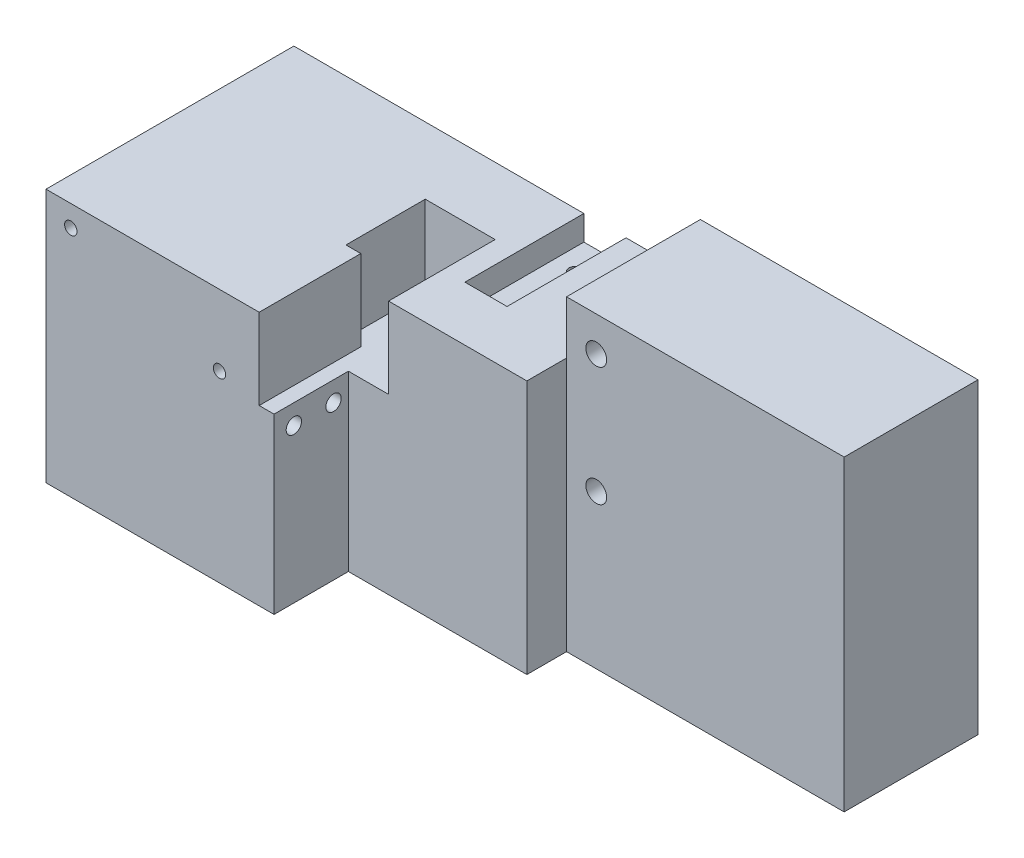
from build123d import *

# Parameters (mm, degrees)
SKETCH1_W                      = 138
SKETCH1_H                      = 50
BOSS_EXTRUDE1_DEPTH            = 62
SKETCH2_W                      = 82
SKETCH2_H                      = 8
CUT_EXTRUDE1_DEPTH             = 160.336122709
SKETCH3_W                      = 56
SKETCH3_H                      = 62
CUT_EXTRUDE2_DEPTH             = 23
CUT_EXTRUDE3_DEPTH             = 19
SKETCH5_W                      = 36
SKETCH5_H                      = 15
CUT_EXTRUDE4_DEPTH             = 157.396930916
M3X0_5_TAPPED_HOLE1_D          = 2.5
M3X0_5_TAPPED_HOLE1_DEPTH      = 12.4
M3X0_5_TAPPED_HOLE1_TIP        = 0.751075774
M4X0_7_TAPPED_HOLE1_D          = 3.3
M4X0_7_TAPPED_HOLE1_DEPTH      = 10.1
M4X0_7_TAPPED_HOLE1_TIP        = 0.991420021
F_3_1_3_1_DIAMETER_HOLE1_D     = 3.1
F_3_1_3_1_DIAMETER_HOLE1_DEPTH = 10
F_3_1_3_1_DIAMETER_HOLE1_TIP   = 0.931333959
SKETCH15_W                     = 82
SKETCH15_H                     = 2.7
CUT_EXTRUDE6_DEPTH             = 160.336122709
SKETCH16_W                     = 8.5
SKETCH16_H                     = 24
CUT_EXTRUDE7_DEPTH             = 5
M3X0_5_TAPPED_HOLE2_D          = 2.5
M3X0_5_TAPPED_HOLE2_DEPTH      = 7.5
M3X0_5_TAPPED_HOLE2_TIP        = 0.751075774
M5X0_8_TAPPED_HOLE1_D          = 4.2
M5X0_8_TAPPED_HOLE1_DEPTH      = 12.4
M5X0_8_TAPPED_HOLE1_TIP        = 1.2618073


with BuildPart() as part:
    # Sketch1 → Boss-Extrude1 (new body)
    with BuildSketch(Plane(origin=(0, 0, 0), x_dir=(1, 0, 0), z_dir=(0, 1, 0))):
        with Locations((69, 25)):
            Rectangle(SKETCH1_W, SKETCH1_H)
    extrude(amount=-BOSS_EXTRUDE1_DEPTH)

    # Sketch2 → Cut-Extrude1 (cut, through all)
    with BuildSketch(Plane.XY):
        with Locations((41, -4)):
            Rectangle(SKETCH2_W, SKETCH2_H)
    extrude(amount=-CUT_EXTRUDE1_DEPTH, mode=Mode.SUBTRACT)

    # Sketch3 → Cut-Extrude2 (cut)
    with BuildSketch(Plane.XY):
        with Locations((110, -31)):
            Rectangle(SKETCH3_W, SKETCH3_H)
    extrude(amount=-CUT_EXTRUDE2_DEPTH, mode=Mode.SUBTRACT)

    # Sketch4 → Cut-Extrude3 (cut)
    with BuildSketch(Plane(origin=(0, -8, 0), x_dir=(1, 0, 0), z_dir=(0, 1, 0))):
        Polygon((40, 36.5), (54.1, 36.5), (54.1, 0), (43, 0), (43, 20.5), (40, 20.5), align=None)
    extrude(amount=-CUT_EXTRUDE3_DEPTH, mode=Mode.SUBTRACT)

    # Sketch5 → Cut-Extrude4 (cut, through all)
    with BuildSketch(Plane(origin=(0, -8, 0), x_dir=(1, 0, 0), z_dir=(0, 1, 0))):
        with Locations((64, 7.5)):
            Rectangle(SKETCH5_W, SKETCH5_H)
    extrude(amount=-CUT_EXTRUDE4_DEPTH, mode=Mode.SUBTRACT)

    # M3x0.5 Tapped Hole1
    with Locations(Plane.XY):
        with Locations((5, -15), (35, -25)):
            Hole(M3X0_5_TAPPED_HOLE1_D / 2, depth=M3X0_5_TAPPED_HOLE1_DEPTH)
            with Locations((0, 0, -(M3X0_5_TAPPED_HOLE1_DEPTH + M3X0_5_TAPPED_HOLE1_TIP / 2))):  # 118° drill point
                Cone(0, M3X0_5_TAPPED_HOLE1_D / 2, M3X0_5_TAPPED_HOLE1_TIP, mode=Mode.SUBTRACT)

    # M4x0.7 Tapped Hole1
    with Locations(Plane(origin=(0, -62, 0), x_dir=(-1, 0, 0), z_dir=(0, -1, 0))):
        with Locations((-128, 35), (-10, 35)):
            Hole(M4X0_7_TAPPED_HOLE1_D / 2, depth=M4X0_7_TAPPED_HOLE1_DEPTH)
            with Locations((0, 0, -(M4X0_7_TAPPED_HOLE1_DEPTH + M4X0_7_TAPPED_HOLE1_TIP / 2))):  # 118° drill point
                Cone(0, M4X0_7_TAPPED_HOLE1_D / 2, M4X0_7_TAPPED_HOLE1_TIP, mode=Mode.SUBTRACT)

    # Ø3.1 (3.1) Diameter Hole1
    with Locations(Plane(origin=(46, 0, 0), x_dir=(0, 0, -1), z_dir=(1, 0, 0))):
        with Locations((4, -31), (12, -31)):
            Hole(F_3_1_3_1_DIAMETER_HOLE1_D / 2, depth=F_3_1_3_1_DIAMETER_HOLE1_DEPTH)
            with Locations((0, 0, -(F_3_1_3_1_DIAMETER_HOLE1_DEPTH + F_3_1_3_1_DIAMETER_HOLE1_TIP / 2))):  # 118° drill point
                Cone(0, F_3_1_3_1_DIAMETER_HOLE1_D / 2, F_3_1_3_1_DIAMETER_HOLE1_TIP, mode=Mode.SUBTRACT)

    # Sketch15 → Cut-Extrude6 (cut, through all)
    with BuildSketch(Plane.XY):
        with Locations((41, -9.35)):
            Rectangle(SKETCH15_W, SKETCH15_H)
    extrude(amount=-CUT_EXTRUDE6_DEPTH, mode=Mode.SUBTRACT)

    # Sketch16 → Cut-Extrude7 (cut)
    with BuildSketch(Plane(origin=(0, -10.7, 0), x_dir=(1, 0, 0), z_dir=(0, 1, 0))):
        with Locations((62.75, 38)):
            Rectangle(SKETCH16_W, SKETCH16_H)
    extrude(amount=-CUT_EXTRUDE7_DEPTH, mode=Mode.SUBTRACT)

    # M3x0.5 Tapped Hole2
    with Locations(Plane(origin=(0, -15.7, 0), x_dir=(1, 0, 0), z_dir=(0, 1, 0))):
        with Locations((62.75, 44)):
            Hole(M3X0_5_TAPPED_HOLE2_D / 2, depth=M3X0_5_TAPPED_HOLE2_DEPTH)
            with Locations((0, 0, -(M3X0_5_TAPPED_HOLE2_DEPTH + M3X0_5_TAPPED_HOLE2_TIP / 2))):  # 118° drill point
                Cone(0, M3X0_5_TAPPED_HOLE2_D / 2, M3X0_5_TAPPED_HOLE2_TIP, mode=Mode.SUBTRACT)

    # M5x0.8 Tapped Hole1
    with Locations(Plane.XY.offset(-23)):
        with Locations((88, -7), (88, -31)):
            Hole(M5X0_8_TAPPED_HOLE1_D / 2, depth=M5X0_8_TAPPED_HOLE1_DEPTH)
            with Locations((0, 0, -(M5X0_8_TAPPED_HOLE1_DEPTH + M5X0_8_TAPPED_HOLE1_TIP / 2))):  # 118° drill point
                Cone(0, M5X0_8_TAPPED_HOLE1_D / 2, M5X0_8_TAPPED_HOLE1_TIP, mode=Mode.SUBTRACT)


solid = part.part
